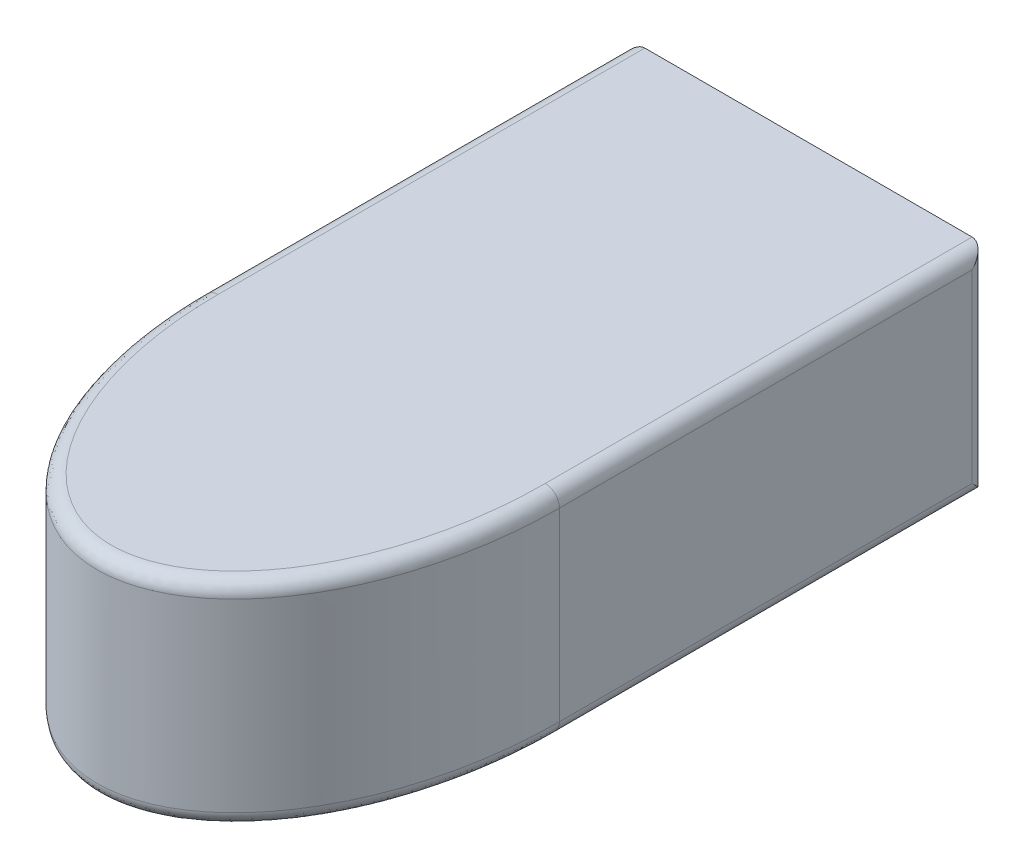
from build123d import *

# Parameters (mm, degrees)
SKETCH1_W           = 25
SKETCH1_H           = 15
BASE_DEPTH          = 30
SKETCH1_3_R         = 1.1
M2X10MM_PIN_DEPTH   = 5.1
BOSS_EXTRUDE2_DEPTH = 15
FILLET1_R           = 1


with BuildPart() as part:
    # Sketch1 → base (new body)
    with BuildSketch(Plane.XY):
        Rectangle(SKETCH1_W, SKETCH1_H)
    extrude(amount=BASE_DEPTH)

    # Sketch1<3> → m2x10mm_pin (cut)
    with BuildSketch(Plane.XY):
        with Locations((-8, 5)):
            Circle(SKETCH1_3_R)
        with Locations(Location((8, 5, 0), (0, 0, 180))):
            Circle(SKETCH1_3_R)
        with Locations((8, -5)):
            Circle(SKETCH1_3_R)
        with Locations(Location((-8, -5, 0), (0, 0, 180))):
            Circle(SKETCH1_3_R)
    extrude(amount=M2X10MM_PIN_DEPTH, mode=Mode.SUBTRACT)

    # Sketch2 → Boss-Extrude2 (add)
    with BuildSketch(Plane.XZ.offset(7.5)):
        with BuildLine():
            add(Edge.make_bspline(
                [(-12.5, 30), (-12.5, 10), (0, 10), (12.5, 10), (12.5, 30)],
                knots=[1.570796327, 1.570796327, 1.570796327, 3.141592654, 3.141592654, 4.71238898, 4.71238898, 4.71238898], degree=2, weights=[1, 0.707106781, 1, 0.707106781, 1]))
            Line((12.5, 30), (-12.5, 30))
        make_face()
        with BuildLine():
            Line((-12.5, 30), (12.5, 30))
            add(Edge.make_bspline(
                [(12.5, 30), (12.5, 50), (0, 50)],
                knots=[4.71238898, 4.71238898, 4.71238898, 6.283185307, 6.283185307, 6.283185307], degree=2, weights=[1, 0.707106781, 1]))
            add(Edge.make_bspline(
                [(0, 50), (-12.5, 50), (-12.5, 30)],
                knots=[0, 0, 0, 1.570796327, 1.570796327, 1.570796327], degree=2, weights=[1, 0.707106781, 1]))
        make_face()
    extrude(amount=-BOSS_EXTRUDE2_DEPTH)

    # Fillet1
    fillet1_edges = [part.edges().sort_by_distance(p)[0] for p in [
        (-9.747017885, -7.5, 42.521535226),
        (-9.747017885, 7.5, 42.521535226),
        (12.5, 0, 0),
        (-12.5, 0, 0),
        (12.5, -7.5, 15),
        (12.5, 7.5, 15),
        (-12.5, 7.5, 15),
        (-12.5, -7.5, 15),
    ]]
    fillet(fillet1_edges, radius=FILLET1_R)


solid = part.part
